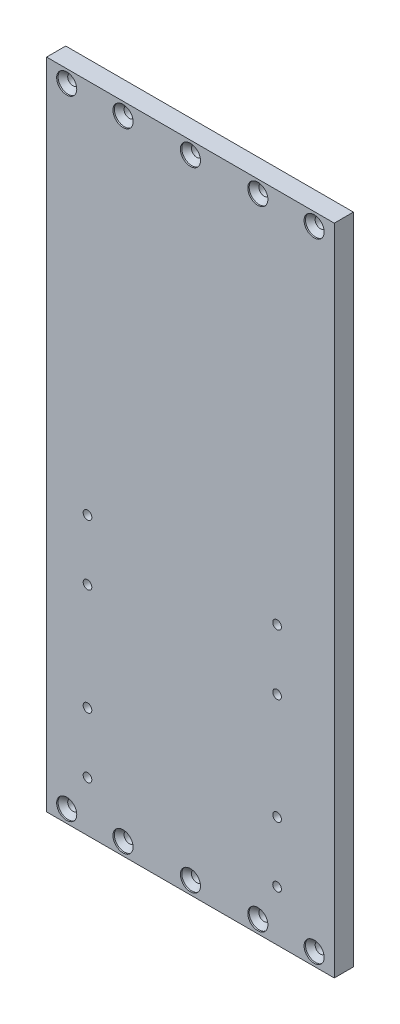
from build123d import *

# Parameters (mm, degrees)
ESBO_O1_W                        = 143.01
ESBO_O1_H                        = 325
RESSALTO_EXTRUS_O1_DEPTH         = 9.52
ESBO_O3_R                        = 2.15
CORTE_EXTRUS_O2_DEPTH            = 10
ESBO_O4_R                        = 2.6
CORTE_EXTRUS_O3_DEPTH            = 9.52
ESBO_O5_R                        = 4
CORTE_EXTRUS_O4_DEPTH            = 0.7
ESBO_O8_R                        = 5
CORTE_EXTRUS_O6_DEPTH            = 0.7
CROQUIS2_R                       = 5
CORTAR_EXTRUIR2_DEPTH            = 2.5
CORTAR_EXTRUIR2_DRAFT            = -45
CORTAR_EXTRUIR2_PROFILE_2_DEPTH  = 2.5
CORTAR_EXTRUIR2_PROFILE_2_DRAFT  = -45
CORTAR_EXTRUIR2_PROFILE_3_DEPTH  = 2.5
CORTAR_EXTRUIR2_PROFILE_3_DRAFT  = -45
CORTAR_EXTRUIR2_PROFILE_4_DEPTH  = 2.5
CORTAR_EXTRUIR2_PROFILE_4_DRAFT  = -45
CORTAR_EXTRUIR2_PROFILE_5_DEPTH  = 2.5
CORTAR_EXTRUIR2_PROFILE_5_DRAFT  = -45
CORTAR_EXTRUIR2_PROFILE_6_DEPTH  = 2.5
CORTAR_EXTRUIR2_PROFILE_6_DRAFT  = -45
CORTAR_EXTRUIR2_PROFILE_7_DEPTH  = 2.5
CORTAR_EXTRUIR2_PROFILE_7_DRAFT  = -45
CORTAR_EXTRUIR2_PROFILE_8_DEPTH  = 2.5
CORTAR_EXTRUIR2_PROFILE_8_DRAFT  = -45
CORTAR_EXTRUIR2_PROFILE_9_DEPTH  = 2.5
CORTAR_EXTRUIR2_PROFILE_9_DRAFT  = -45
CORTAR_EXTRUIR2_PROFILE_10_DEPTH = 2.5
CORTAR_EXTRUIR2_PROFILE_10_DRAFT = -45
CROQUIS3_R                       = 4
CORTAR_EXTRUIR3_DEPTH            = 2
CORTAR_EXTRUIR3_DRAFT            = -45
CORTAR_EXTRUIR3_PROFILE_2_DEPTH  = 2
CORTAR_EXTRUIR3_PROFILE_2_DRAFT  = -45
CORTAR_EXTRUIR3_PROFILE_3_DEPTH  = 2
CORTAR_EXTRUIR3_PROFILE_3_DRAFT  = -45
CORTAR_EXTRUIR3_PROFILE_4_DEPTH  = 2
CORTAR_EXTRUIR3_PROFILE_4_DRAFT  = -45
CORTAR_EXTRUIR3_PROFILE_5_DEPTH  = 2
CORTAR_EXTRUIR3_PROFILE_5_DRAFT  = -45
CORTAR_EXTRUIR3_PROFILE_6_DEPTH  = 2
CORTAR_EXTRUIR3_PROFILE_6_DRAFT  = -45
CORTAR_EXTRUIR3_PROFILE_7_DEPTH  = 2
CORTAR_EXTRUIR3_PROFILE_7_DRAFT  = -45
CORTAR_EXTRUIR3_PROFILE_8_DEPTH  = 2
CORTAR_EXTRUIR3_PROFILE_8_DRAFT  = -45


with BuildPart() as part:
    # Esboço1 → Ressalto-extrusão1 (new body)
    with BuildSketch(Plane.XY):
        Rectangle(ESBO_O1_W, ESBO_O1_H)
    extrude(amount=RESSALTO_EXTRUS_O1_DEPTH)

    # Esboço3 → Corte-extrusão2 (cut)
    with BuildSketch(Plane.XY.offset(9.52)):
        with Locations((-51.175, -24.49)):
            Circle(ESBO_O3_R)
        with Locations((-51.175, -54.49)):
            Circle(ESBO_O3_R)
        with Locations((-51.175, -107.5)):
            Circle(ESBO_O3_R)
        with Locations((-51.175, -137.5)):
            Circle(ESBO_O3_R)
        with Locations((43.075, -137.4)):
            Circle(ESBO_O3_R)
        with Locations((43.075, -107.4)):
            Circle(ESBO_O3_R)
        with Locations((43.075, -54.59)):
            Circle(ESBO_O3_R)
        with Locations((43.075, -24.59)):
            Circle(ESBO_O3_R)
    extrude(amount=-CORTE_EXTRUS_O2_DEPTH, mode=Mode.SUBTRACT)

    # Esboço4 → Corte-extrusão3 (cut)
    with BuildSketch(Plane(origin=(0, 0, 0), x_dir=(-1, 0, 0), z_dir=(0, 0, -1))):
        with Locations(Location((61.505, 156.15, 0), (0, 0, 180))):
            Circle(ESBO_O4_R)
        with Locations(Location((33.505, 156.15, 0), (0, 0, 180))):
            Circle(ESBO_O4_R)
        with Locations(Location((0, 156.15, 0), (0, 0, 180))):
            Circle(ESBO_O4_R)
        with Locations((61.505, -156.15)):
            Circle(ESBO_O4_R)
        with Locations((0, -156.15)):
            Circle(ESBO_O4_R)
        with Locations((-61.505, -156.15)):
            Circle(ESBO_O4_R)
        with Locations(Location((-33.505, 156.15, 0), (0, 0, 180))):
            Circle(ESBO_O4_R)
        with Locations(Location((-61.505, 156.15, 0), (0, 0, 180))):
            Circle(ESBO_O4_R)
        with Locations((33.505, -156.15)):
            Circle(ESBO_O4_R)
        with Locations((-33.505, -156.15)):
            Circle(ESBO_O4_R)
    extrude(amount=-CORTE_EXTRUS_O3_DEPTH, mode=Mode.SUBTRACT)

    # Esboço5 → Corte-extrusão4 (cut)
    with BuildSketch(Plane(origin=(0, 0, 0), x_dir=(-1, 0, 0), z_dir=(0, 0, -1))):
        with Locations(Location((51.175, -24.49, 0), (0, 0, 180))):
            Circle(ESBO_O5_R)
        with Locations(Location((51.175, -54.49, 0), (0, 0, 180))):
            Circle(ESBO_O5_R)
        with Locations((-43.075, -54.59)):
            Circle(ESBO_O5_R)
        with Locations((-43.075, -24.59)):
            Circle(ESBO_O5_R)
        with Locations(Location((-43.075, -137.4, 0), (0, 0, 180))):
            Circle(ESBO_O5_R)
        with Locations(Location((-43.075, -107.4, 0), (0, 0, 180))):
            Circle(ESBO_O5_R)
        with Locations((51.175, -107.5)):
            Circle(ESBO_O5_R)
        with Locations((51.175, -137.5)):
            Circle(ESBO_O5_R)
    extrude(amount=-CORTE_EXTRUS_O4_DEPTH, mode=Mode.SUBTRACT)

    # Esboço8 → Corte-extrusão6 (cut)
    with BuildSketch(Plane.XY.offset(9.52)):
        with Locations((-61.505, 156.15)):
            Circle(ESBO_O8_R)
        with Locations((-33.505, 156.15)):
            Circle(ESBO_O8_R)
        with Locations((0, 156.15)):
            Circle(ESBO_O8_R)
        with Locations(Location((-61.505, -156.15, 0), (0, 0, 180))):
            Circle(ESBO_O8_R)
        with Locations(Location((-33.505, -156.15, 0), (0, 0, 180))):
            Circle(ESBO_O8_R)
        with Locations(Location((33.505, 156.15, 0), (0, 0, 180))):
            Circle(ESBO_O8_R)
        with Locations(Location((61.505, 156.15, 0), (0, 0, 180))):
            Circle(ESBO_O8_R)
        with Locations(Location((0, -156.15, 0), (0, 0, 180))):
            Circle(ESBO_O8_R)
        with Locations((33.505, -156.15)):
            Circle(ESBO_O8_R)
        with Locations((61.505, -156.15)):
            Circle(ESBO_O8_R)
    extrude(amount=-CORTE_EXTRUS_O6_DEPTH, mode=Mode.SUBTRACT)


with BuildPart() as cortar_extruir2_tool:
    # Croquis2 → Cortar-Extruir2 (with draft: the straight prism first)
    with BuildSketch(Plane.XY.offset(8.82)):
        with Locations((61.505, 156.15)):
            Circle(CROQUIS2_R)
    extrude(amount=-CORTAR_EXTRUIR2_DEPTH)
    # Cortar-Extruir2: the draft: its side faces are tilted about the plane it starts from
    cortar_extruir2_sides = [cortar_extruir2_tool.faces().sort_by_distance(p)[0] for p in [
        (56.505, 156.15, 7.57),
    ]]
    draft(cortar_extruir2_sides, Plane.XY.offset(8.82), CORTAR_EXTRUIR2_DRAFT)


with BuildPart() as part_1:
    add(part.part)

    # Cortar-Extruir2: cut by cortar_extruir2_tool
    add(cortar_extruir2_tool.part, mode=Mode.SUBTRACT)


with BuildPart() as cortar_extruir2_profile_2_tool:
    # Croquis2 → Cortar-Extruir2 profile 2 (with draft: the straight prism first)
    with BuildSketch(Plane.XY.offset(8.82)):
        with Locations((33.505, 156.15)):
            Circle(CROQUIS2_R)
    extrude(amount=-CORTAR_EXTRUIR2_PROFILE_2_DEPTH)
    # Cortar-Extruir2 profile 2: the draft: its side faces are tilted about the plane it starts from
    cortar_extruir2_profile_2_sides = [cortar_extruir2_profile_2_tool.faces().sort_by_distance(p)[0] for p in [
        (28.505, 156.15, 7.57),
    ]]
    draft(cortar_extruir2_profile_2_sides, Plane.XY.offset(8.82), CORTAR_EXTRUIR2_PROFILE_2_DRAFT)


with BuildPart() as part_2:
    add(part_1.part)

    # Cortar-Extruir2 profile 2: cut by cortar_extruir2_profile_2_tool
    add(cortar_extruir2_profile_2_tool.part, mode=Mode.SUBTRACT)


with BuildPart() as cortar_extruir2_profile_3_tool:
    # Croquis2 → Cortar-Extruir2 profile 3 (with draft: the straight prism first)
    with BuildSketch(Plane.XY.offset(8.82)):
        with Locations((0, 156.15)):
            Circle(CROQUIS2_R)
    extrude(amount=-CORTAR_EXTRUIR2_PROFILE_3_DEPTH)
    # Cortar-Extruir2 profile 3: the draft: its side faces are tilted about the plane it starts from
    cortar_extruir2_profile_3_sides = [cortar_extruir2_profile_3_tool.faces().sort_by_distance(p)[0] for p in [
        (-5, 156.15, 7.57),
    ]]
    draft(cortar_extruir2_profile_3_sides, Plane.XY.offset(8.82), CORTAR_EXTRUIR2_PROFILE_3_DRAFT)


with BuildPart() as part_3:
    add(part_2.part)

    # Cortar-Extruir2 profile 3: cut by cortar_extruir2_profile_3_tool
    add(cortar_extruir2_profile_3_tool.part, mode=Mode.SUBTRACT)


with BuildPart() as cortar_extruir2_profile_4_tool:
    # Croquis2 → Cortar-Extruir2 profile 4 (with draft: the straight prism first)
    with BuildSketch(Plane.XY.offset(8.82)):
        with Locations((-61.505, 156.15)):
            Circle(CROQUIS2_R)
    extrude(amount=-CORTAR_EXTRUIR2_PROFILE_4_DEPTH)
    # Cortar-Extruir2 profile 4: the draft: its side faces are tilted about the plane it starts from
    cortar_extruir2_profile_4_sides = [cortar_extruir2_profile_4_tool.faces().sort_by_distance(p)[0] for p in [
        (-66.505, 156.15, 7.57),
    ]]
    draft(cortar_extruir2_profile_4_sides, Plane.XY.offset(8.82), CORTAR_EXTRUIR2_PROFILE_4_DRAFT)


with BuildPart() as part_4:
    add(part_3.part)

    # Cortar-Extruir2 profile 4: cut by cortar_extruir2_profile_4_tool
    add(cortar_extruir2_profile_4_tool.part, mode=Mode.SUBTRACT)


with BuildPart() as cortar_extruir2_profile_5_tool:
    # Croquis2 → Cortar-Extruir2 profile 5 (with draft: the straight prism first)
    with BuildSketch(Plane.XY.offset(8.82)):
        with Locations((-33.505, 156.15)):
            Circle(CROQUIS2_R)
    extrude(amount=-CORTAR_EXTRUIR2_PROFILE_5_DEPTH)
    # Cortar-Extruir2 profile 5: the draft: its side faces are tilted about the plane it starts from
    cortar_extruir2_profile_5_sides = [cortar_extruir2_profile_5_tool.faces().sort_by_distance(p)[0] for p in [
        (-38.505, 156.15, 7.57),
    ]]
    draft(cortar_extruir2_profile_5_sides, Plane.XY.offset(8.82), CORTAR_EXTRUIR2_PROFILE_5_DRAFT)


with BuildPart() as part_5:
    add(part_4.part)

    # Cortar-Extruir2 profile 5: cut by cortar_extruir2_profile_5_tool
    add(cortar_extruir2_profile_5_tool.part, mode=Mode.SUBTRACT)


with BuildPart() as cortar_extruir2_profile_6_tool:
    # Croquis2 → Cortar-Extruir2 profile 6 (with draft: the straight prism first)
    with BuildSketch(Plane.XY.offset(8.82)):
        with Locations((61.505, -156.15)):
            Circle(CROQUIS2_R)
    extrude(amount=-CORTAR_EXTRUIR2_PROFILE_6_DEPTH)
    # Cortar-Extruir2 profile 6: the draft: its side faces are tilted about the plane it starts from
    cortar_extruir2_profile_6_sides = [cortar_extruir2_profile_6_tool.faces().sort_by_distance(p)[0] for p in [
        (56.505, -156.15, 7.57),
    ]]
    draft(cortar_extruir2_profile_6_sides, Plane.XY.offset(8.82), CORTAR_EXTRUIR2_PROFILE_6_DRAFT)


with BuildPart() as part_6:
    add(part_5.part)

    # Cortar-Extruir2 profile 6: cut by cortar_extruir2_profile_6_tool
    add(cortar_extruir2_profile_6_tool.part, mode=Mode.SUBTRACT)


with BuildPart() as cortar_extruir2_profile_7_tool:
    # Croquis2 → Cortar-Extruir2 profile 7 (with draft: the straight prism first)
    with BuildSketch(Plane.XY.offset(8.82)):
        with Locations((33.505, -156.15)):
            Circle(CROQUIS2_R)
    extrude(amount=-CORTAR_EXTRUIR2_PROFILE_7_DEPTH)
    # Cortar-Extruir2 profile 7: the draft: its side faces are tilted about the plane it starts from
    cortar_extruir2_profile_7_sides = [cortar_extruir2_profile_7_tool.faces().sort_by_distance(p)[0] for p in [
        (28.505, -156.15, 7.57),
    ]]
    draft(cortar_extruir2_profile_7_sides, Plane.XY.offset(8.82), CORTAR_EXTRUIR2_PROFILE_7_DRAFT)


with BuildPart() as part_7:
    add(part_6.part)

    # Cortar-Extruir2 profile 7: cut by cortar_extruir2_profile_7_tool
    add(cortar_extruir2_profile_7_tool.part, mode=Mode.SUBTRACT)


with BuildPart() as cortar_extruir2_profile_8_tool:
    # Croquis2 → Cortar-Extruir2 profile 8 (with draft: the straight prism first)
    with BuildSketch(Plane.XY.offset(8.82)):
        with Locations(Location((0, -156.15, 0), (0, 0, 180))):
            Circle(CROQUIS2_R)
    extrude(amount=-CORTAR_EXTRUIR2_PROFILE_8_DEPTH)
    # Cortar-Extruir2 profile 8: the draft: its side faces are tilted about the plane it starts from
    cortar_extruir2_profile_8_sides = [cortar_extruir2_profile_8_tool.faces().sort_by_distance(p)[0] for p in [
        (5, -156.15, 7.57),
    ]]
    draft(cortar_extruir2_profile_8_sides, Plane.XY.offset(8.82), CORTAR_EXTRUIR2_PROFILE_8_DRAFT)


with BuildPart() as part_8:
    add(part_7.part)

    # Cortar-Extruir2 profile 8: cut by cortar_extruir2_profile_8_tool
    add(cortar_extruir2_profile_8_tool.part, mode=Mode.SUBTRACT)


with BuildPart() as cortar_extruir2_profile_9_tool:
    # Croquis2 → Cortar-Extruir2 profile 9 (with draft: the straight prism first)
    with BuildSketch(Plane.XY.offset(8.82)):
        with Locations((-33.505, -156.15)):
            Circle(CROQUIS2_R)
    extrude(amount=-CORTAR_EXTRUIR2_PROFILE_9_DEPTH)
    # Cortar-Extruir2 profile 9: the draft: its side faces are tilted about the plane it starts from
    cortar_extruir2_profile_9_sides = [cortar_extruir2_profile_9_tool.faces().sort_by_distance(p)[0] for p in [
        (-38.505, -156.15, 7.57),
    ]]
    draft(cortar_extruir2_profile_9_sides, Plane.XY.offset(8.82), CORTAR_EXTRUIR2_PROFILE_9_DRAFT)


with BuildPart() as part_9:
    add(part_8.part)

    # Cortar-Extruir2 profile 9: cut by cortar_extruir2_profile_9_tool
    add(cortar_extruir2_profile_9_tool.part, mode=Mode.SUBTRACT)


with BuildPart() as cortar_extruir2_profile_10_tool:
    # Croquis2 → Cortar-Extruir2 profile 10 (with draft: the straight prism first)
    with BuildSketch(Plane.XY.offset(8.82)):
        with Locations((-61.505, -156.15)):
            Circle(CROQUIS2_R)
    extrude(amount=-CORTAR_EXTRUIR2_PROFILE_10_DEPTH)
    # Cortar-Extruir2 profile 10: the draft: its side faces are tilted about the plane it starts from
    cortar_extruir2_profile_10_sides = [cortar_extruir2_profile_10_tool.faces().sort_by_distance(p)[0] for p in [
        (-66.505, -156.15, 7.57),
    ]]
    draft(cortar_extruir2_profile_10_sides, Plane.XY.offset(8.82), CORTAR_EXTRUIR2_PROFILE_10_DRAFT)


with BuildPart() as part_10:
    add(part_9.part)

    # Cortar-Extruir2 profile 10: cut by cortar_extruir2_profile_10_tool
    add(cortar_extruir2_profile_10_tool.part, mode=Mode.SUBTRACT)


with BuildPart() as cortar_extruir3_tool:
    # Croquis3 → Cortar-Extruir3 (with draft: the straight prism first)
    with BuildSketch(Plane(origin=(0, 0, 0.7), x_dir=(-1, 0, 0), z_dir=(0, 0, -1))):
        with Locations((51.175, -137.5)):
            Circle(CROQUIS3_R)
    extrude(amount=-CORTAR_EXTRUIR3_DEPTH)
    # Cortar-Extruir3: the draft: its side faces are tilted about the plane it starts from
    cortar_extruir3_sides = [cortar_extruir3_tool.faces().sort_by_distance(p)[0] for p in [
        (-47.175, -137.5, 1.7),
    ]]
    draft(cortar_extruir3_sides, Plane(origin=(0, 0, 0.7), x_dir=(-1, 0, 0), z_dir=(0, 0, -1)), CORTAR_EXTRUIR3_DRAFT)


with BuildPart() as part_11:
    add(part_10.part)

    # Cortar-Extruir3: cut by cortar_extruir3_tool
    add(cortar_extruir3_tool.part, mode=Mode.SUBTRACT)


with BuildPart() as cortar_extruir3_profile_2_tool:
    # Croquis3 → Cortar-Extruir3 profile 2 (with draft: the straight prism first)
    with BuildSketch(Plane(origin=(0, 0, 0.7), x_dir=(-1, 0, 0), z_dir=(0, 0, -1))):
        with Locations((51.175, -107.5)):
            Circle(CROQUIS3_R)
    extrude(amount=-CORTAR_EXTRUIR3_PROFILE_2_DEPTH)
    # Cortar-Extruir3 profile 2: the draft: its side faces are tilted about the plane it starts from
    cortar_extruir3_profile_2_sides = [cortar_extruir3_profile_2_tool.faces().sort_by_distance(p)[0] for p in [
        (-47.175, -107.5, 1.7),
    ]]
    draft(cortar_extruir3_profile_2_sides, Plane(origin=(0, 0, 0.7), x_dir=(-1, 0, 0), z_dir=(0, 0, -1)), CORTAR_EXTRUIR3_PROFILE_2_DRAFT)


with BuildPart() as part_12:
    add(part_11.part)

    # Cortar-Extruir3 profile 2: cut by cortar_extruir3_profile_2_tool
    add(cortar_extruir3_profile_2_tool.part, mode=Mode.SUBTRACT)


with BuildPart() as cortar_extruir3_profile_3_tool:
    # Croquis3 → Cortar-Extruir3 profile 3 (with draft: the straight prism first)
    with BuildSketch(Plane(origin=(0, 0, 0.7), x_dir=(-1, 0, 0), z_dir=(0, 0, -1))):
        with Locations((-43.075, -137.4)):
            Circle(CROQUIS3_R)
    extrude(amount=-CORTAR_EXTRUIR3_PROFILE_3_DEPTH)
    # Cortar-Extruir3 profile 3: the draft: its side faces are tilted about the plane it starts from
    cortar_extruir3_profile_3_sides = [cortar_extruir3_profile_3_tool.faces().sort_by_distance(p)[0] for p in [
        (47.075, -137.4, 1.7),
    ]]
    draft(cortar_extruir3_profile_3_sides, Plane(origin=(0, 0, 0.7), x_dir=(-1, 0, 0), z_dir=(0, 0, -1)), CORTAR_EXTRUIR3_PROFILE_3_DRAFT)


with BuildPart() as part_13:
    add(part_12.part)

    # Cortar-Extruir3 profile 3: cut by cortar_extruir3_profile_3_tool
    add(cortar_extruir3_profile_3_tool.part, mode=Mode.SUBTRACT)


with BuildPart() as cortar_extruir3_profile_4_tool:
    # Croquis3 → Cortar-Extruir3 profile 4 (with draft: the straight prism first)
    with BuildSketch(Plane(origin=(0, 0, 0.7), x_dir=(-1, 0, 0), z_dir=(0, 0, -1))):
        with Locations((-43.075, -107.4)):
            Circle(CROQUIS3_R)
    extrude(amount=-CORTAR_EXTRUIR3_PROFILE_4_DEPTH)
    # Cortar-Extruir3 profile 4: the draft: its side faces are tilted about the plane it starts from
    cortar_extruir3_profile_4_sides = [cortar_extruir3_profile_4_tool.faces().sort_by_distance(p)[0] for p in [
        (47.075, -107.4, 1.7),
    ]]
    draft(cortar_extruir3_profile_4_sides, Plane(origin=(0, 0, 0.7), x_dir=(-1, 0, 0), z_dir=(0, 0, -1)), CORTAR_EXTRUIR3_PROFILE_4_DRAFT)


with BuildPart() as part_14:
    add(part_13.part)

    # Cortar-Extruir3 profile 4: cut by cortar_extruir3_profile_4_tool
    add(cortar_extruir3_profile_4_tool.part, mode=Mode.SUBTRACT)


with BuildPart() as cortar_extruir3_profile_5_tool:
    # Croquis3 → Cortar-Extruir3 profile 5 (with draft: the straight prism first)
    with BuildSketch(Plane(origin=(0, 0, 0.7), x_dir=(-1, 0, 0), z_dir=(0, 0, -1))):
        with Locations((-43.075, -54.59)):
            Circle(CROQUIS3_R)
    extrude(amount=-CORTAR_EXTRUIR3_PROFILE_5_DEPTH)
    # Cortar-Extruir3 profile 5: the draft: its side faces are tilted about the plane it starts from
    cortar_extruir3_profile_5_sides = [cortar_extruir3_profile_5_tool.faces().sort_by_distance(p)[0] for p in [
        (47.075, -54.59, 1.7),
    ]]
    draft(cortar_extruir3_profile_5_sides, Plane(origin=(0, 0, 0.7), x_dir=(-1, 0, 0), z_dir=(0, 0, -1)), CORTAR_EXTRUIR3_PROFILE_5_DRAFT)


with BuildPart() as part_15:
    add(part_14.part)

    # Cortar-Extruir3 profile 5: cut by cortar_extruir3_profile_5_tool
    add(cortar_extruir3_profile_5_tool.part, mode=Mode.SUBTRACT)


with BuildPart() as cortar_extruir3_profile_6_tool:
    # Croquis3 → Cortar-Extruir3 profile 6 (with draft: the straight prism first)
    with BuildSketch(Plane(origin=(0, 0, 0.7), x_dir=(-1, 0, 0), z_dir=(0, 0, -1))):
        with Locations((-43.075, -24.59)):
            Circle(CROQUIS3_R)
    extrude(amount=-CORTAR_EXTRUIR3_PROFILE_6_DEPTH)
    # Cortar-Extruir3 profile 6: the draft: its side faces are tilted about the plane it starts from
    cortar_extruir3_profile_6_sides = [cortar_extruir3_profile_6_tool.faces().sort_by_distance(p)[0] for p in [
        (47.075, -24.59, 1.7),
    ]]
    draft(cortar_extruir3_profile_6_sides, Plane(origin=(0, 0, 0.7), x_dir=(-1, 0, 0), z_dir=(0, 0, -1)), CORTAR_EXTRUIR3_PROFILE_6_DRAFT)


with BuildPart() as part_16:
    add(part_15.part)

    # Cortar-Extruir3 profile 6: cut by cortar_extruir3_profile_6_tool
    add(cortar_extruir3_profile_6_tool.part, mode=Mode.SUBTRACT)


with BuildPart() as cortar_extruir3_profile_7_tool:
    # Croquis3 → Cortar-Extruir3 profile 7 (with draft: the straight prism first)
    with BuildSketch(Plane(origin=(0, 0, 0.7), x_dir=(-1, 0, 0), z_dir=(0, 0, -1))):
        with Locations((51.175, -54.49)):
            Circle(CROQUIS3_R)
    extrude(amount=-CORTAR_EXTRUIR3_PROFILE_7_DEPTH)
    # Cortar-Extruir3 profile 7: the draft: its side faces are tilted about the plane it starts from
    cortar_extruir3_profile_7_sides = [cortar_extruir3_profile_7_tool.faces().sort_by_distance(p)[0] for p in [
        (-47.175, -54.49, 1.7),
    ]]
    draft(cortar_extruir3_profile_7_sides, Plane(origin=(0, 0, 0.7), x_dir=(-1, 0, 0), z_dir=(0, 0, -1)), CORTAR_EXTRUIR3_PROFILE_7_DRAFT)


with BuildPart() as part_17:
    add(part_16.part)

    # Cortar-Extruir3 profile 7: cut by cortar_extruir3_profile_7_tool
    add(cortar_extruir3_profile_7_tool.part, mode=Mode.SUBTRACT)


with BuildPart() as cortar_extruir3_profile_8_tool:
    # Croquis3 → Cortar-Extruir3 profile 8 (with draft: the straight prism first)
    with BuildSketch(Plane(origin=(0, 0, 0.7), x_dir=(-1, 0, 0), z_dir=(0, 0, -1))):
        with Locations((51.175, -24.49)):
            Circle(CROQUIS3_R)
    extrude(amount=-CORTAR_EXTRUIR3_PROFILE_8_DEPTH)
    # Cortar-Extruir3 profile 8: the draft: its side faces are tilted about the plane it starts from
    cortar_extruir3_profile_8_sides = [cortar_extruir3_profile_8_tool.faces().sort_by_distance(p)[0] for p in [
        (-47.175, -24.49, 1.7),
    ]]
    draft(cortar_extruir3_profile_8_sides, Plane(origin=(0, 0, 0.7), x_dir=(-1, 0, 0), z_dir=(0, 0, -1)), CORTAR_EXTRUIR3_PROFILE_8_DRAFT)


with BuildPart() as part_18:
    add(part_17.part)

    # Cortar-Extruir3 profile 8: cut by cortar_extruir3_profile_8_tool
    add(cortar_extruir3_profile_8_tool.part, mode=Mode.SUBTRACT)


solid = part_18.part
